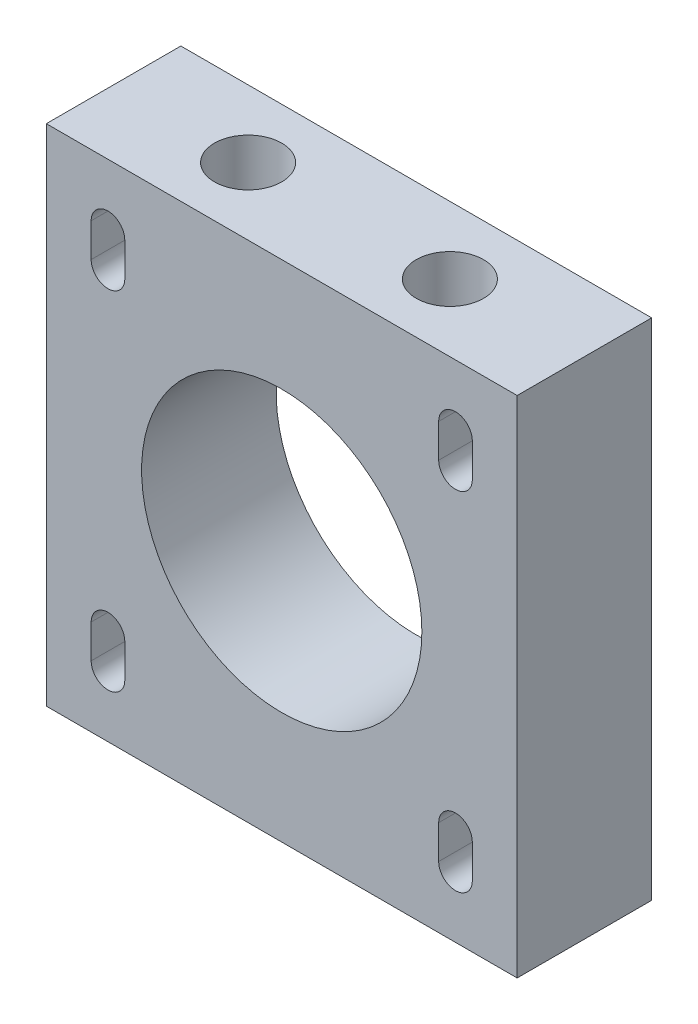
from build123d import *

# Parameters (mm, degrees)
SKETCH_1_W          = 42
SKETCH_1_H          = 45
SKETCH_1_R          = 12.5
EXTRUDE_1_DEPTH     = 12
SKETCH_2_R          = 3
CUT_EXTRUDE_2_DEPTH = 10


with BuildPart() as part:
    # 草图1 → 凸台-拉伸1 (new body)
    with BuildSketch(Plane.XY):
        Rectangle(SKETCH_1_W, SKETCH_1_H)
        Circle(SKETCH_1_R, mode=Mode.SUBTRACT)
        with BuildLine():
            Line((-14, 17), (-14, 14))
            ThreePointArc((-14, 14), (-15.5, 12.5), (-17, 14))
            Line((-17, 14), (-17, 17))
            ThreePointArc((-17, 17), (-15.5, 18.5), (-14, 17))
        make_face(mode=Mode.SUBTRACT)
        with BuildLine():
            Line((14, 17), (14, 14))
            ThreePointArc((14, 14), (15.5, 12.5), (17, 14))
            Line((17, 14), (17, 17))
            ThreePointArc((17, 17), (15.5, 18.5), (14, 17))
        make_face(mode=Mode.SUBTRACT)
        with BuildLine():
            Line((14, -17), (14, -14))
            ThreePointArc((14, -14), (15.5, -12.5), (17, -14))
            Line((17, -14), (17, -17))
            ThreePointArc((17, -17), (15.5, -18.5), (14, -17))
        make_face(mode=Mode.SUBTRACT)
        with BuildLine():
            Line((-14, -17), (-14, -14))
            ThreePointArc((-14, -14), (-15.5, -12.5), (-17, -14))
            Line((-17, -14), (-17, -17))
            ThreePointArc((-17, -17), (-15.5, -18.5), (-14, -17))
        make_face(mode=Mode.SUBTRACT)
    extrude(amount=EXTRUDE_1_DEPTH)

    # 草图2 → 切除-拉伸2 (cut)
    with BuildSketch(Plane(origin=(0, 22.5, 0), x_dir=(1, 0, 0), z_dir=(0, 1, 0))):
        with Locations(Location((-9, -6, 0), (0, 0, 180))):
            Circle(SKETCH_2_R)
        with Locations(Location((9, -6, 0), (0, 0, 180))):
            Circle(SKETCH_2_R)
    extrude(amount=-CUT_EXTRUDE_2_DEPTH, mode=Mode.SUBTRACT)


solid = part.part
